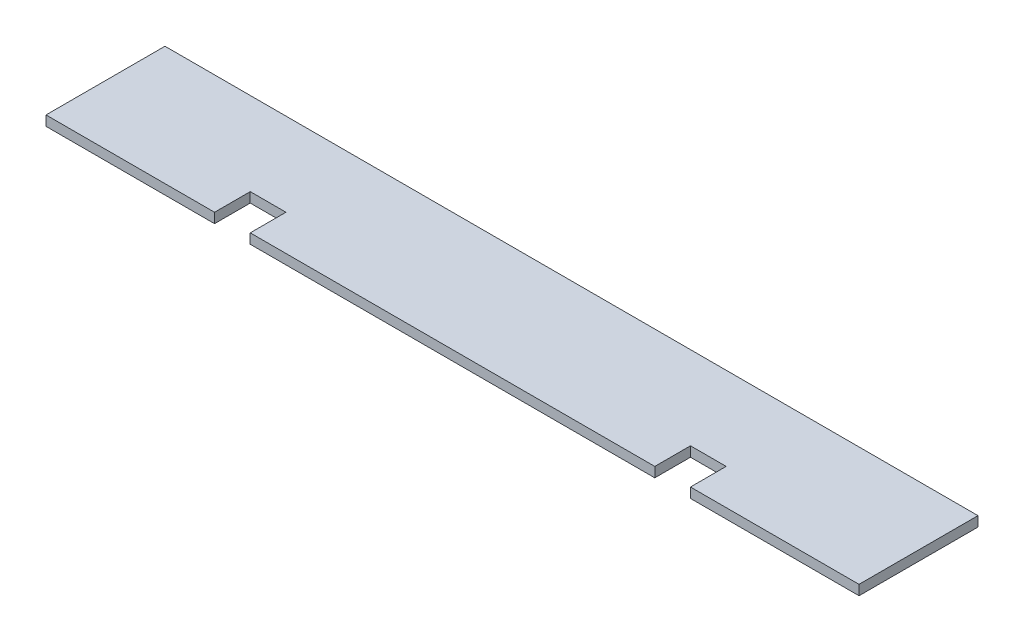
from build123d import *

# Parameters (mm, degrees)
SKETCH1_W           = 2050
SKETCH1_H           = 300
BOSS_EXTRUDE1_DEPTH = 25
CUT_EXTRUDE1_REACH  = 2073.986
SKETCH2_W           = 90
SKETCH2_H           = 90


with BuildPart() as part:
    # Sketch1 → Boss-Extrude1 (new body)
    with BuildSketch(Plane(origin=(0, 0, 0), x_dir=(1, 0, 0), z_dir=(0, 1, 0))):
        with Locations((1025, 150)):
            Rectangle(SKETCH1_W, SKETCH1_H)
    extrude(amount=BOSS_EXTRUDE1_DEPTH)

    # Sketch2 → Cut-Extrude1 (cut, up to next)
    with BuildSketch(Plane(origin=(0, 25, 0), x_dir=(1, 0, 0), z_dir=(0, 1, 0)), mode=Mode.PRIVATE) as cut_extrude1_sk1:
        with Locations((470, 45)):
            Rectangle(SKETCH2_W, SKETCH2_H)
    cut_extrude1_tool1 = extrude(cut_extrude1_sk1.sketch, amount=-CUT_EXTRUDE1_REACH, mode=Mode.PRIVATE) & part.part
    # Sketch2 → Cut-Extrude1 (cut, up to next)
    with BuildSketch(Plane(origin=(0, 25, 0), x_dir=(1, 0, 0), z_dir=(0, 1, 0)), mode=Mode.PRIVATE) as cut_extrude1_sk2:
        with Locations((1580, 45)):
            Rectangle(SKETCH2_W, SKETCH2_H)
    cut_extrude1_tool2 = extrude(cut_extrude1_sk2.sketch, amount=-CUT_EXTRUDE1_REACH, mode=Mode.PRIVATE) & part.part
    add(cut_extrude1_tool1.solids().sort_by_distance((470, 25, -45))[0], mode=Mode.SUBTRACT)
    add(cut_extrude1_tool2.solids().sort_by_distance((1580, 25, -45))[0], mode=Mode.SUBTRACT)


solid = part.part
